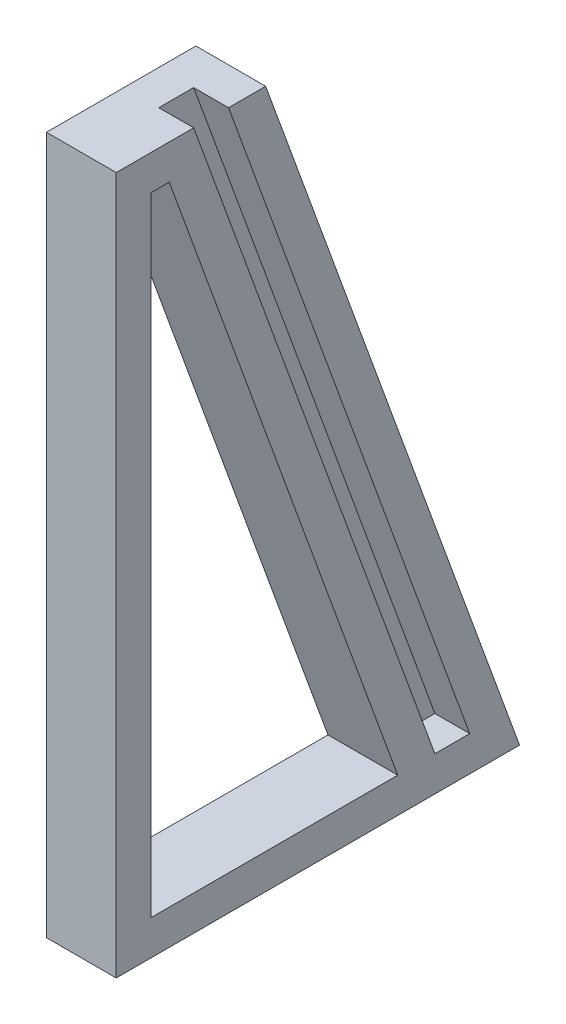
from build123d import *

# Parameters (mm, degrees)
SKETCH1_W           = 100
SKETCH1_H           = 100
BOSS_EXTRUDE1_DEPTH = 10
CUT_EXTRUDE1_DEPTH  = 10
SKETCH4_W           = 6
SKETCH4_H           = 6
CUT_EXTRUDE3_DEPTH  = 4
CUT_EXTRUDE5_DEPTH  = 10
CUT_EXTRUDE6_DEPTH  = 5
BOSS_EXTRUDE2_DEPTH = 10


with BuildPart() as part:
    # Sketch1 → Boss-Extrude1 (new body)
    with BuildSketch(Plane(origin=(0, 0, 0), x_dir=(0, 0, -1), z_dir=(1, 0, 0))):
        Rectangle(SKETCH1_W, SKETCH1_H)
    extrude(amount=BOSS_EXTRUDE1_DEPTH)

    # Sketch2 → Cut-Extrude1 (cut)
    with BuildSketch(Plane.ZY):
        Polygon((45, -45), (45, 45), (42.398061118, 45), (9.640740034, -45), align=None)
    extrude(amount=-CUT_EXTRUDE1_DEPTH, mode=Mode.SUBTRACT)

    # Sketch4 → Cut-Extrude3 (cut)
    with BuildSketch(Plane.XZ.offset(50)):
        with Locations((5, 45)):
            Rectangle(SKETCH4_W, SKETCH4_H)
        with Locations((5, 5.32088886)):
            Rectangle(SKETCH4_W, SKETCH4_H)
        with Locations((5, -45)):
            Rectangle(SKETCH4_W, SKETCH4_H)
    extrude(amount=-CUT_EXTRUDE3_DEPTH, mode=Mode.SUBTRACT)

    # Sketch2<4> → Cut-Extrude5 (cut)
    with BuildSketch(Plane.ZY):
        Polygon((-50, 50), (-50, -50), (-2.5, -50), (-0.680148829, -45), (33.897023427, 50), align=None)
    extrude(amount=-CUT_EXTRUDE5_DEPTH, mode=Mode.SUBTRACT)

    # Sketch6 → Cut-Extrude6 (cut)
    with BuildSketch(Plane(origin=(10, 0, 0), x_dir=(0, 0, -1), z_dir=(1, 0, 0))):
        Polygon((-38.897023427, 50), (-33.897023427, 50), (0.680148829, -45), (-4.319851171, -45), align=None)
    extrude(amount=-CUT_EXTRUDE6_DEPTH, mode=Mode.SUBTRACT)

    # Sketch8 → Boss-Extrude2 (add)
    with BuildSketch(Plane.ZY):
        Polygon((-2.5, -50), (33.897023427, 50), (28.576134564, 50), (26.756283393, 45), (-6.001037691, -45), (-7.820888862, -50), align=None)
    extrude(amount=-BOSS_EXTRUDE2_DEPTH)


solid = part.part
